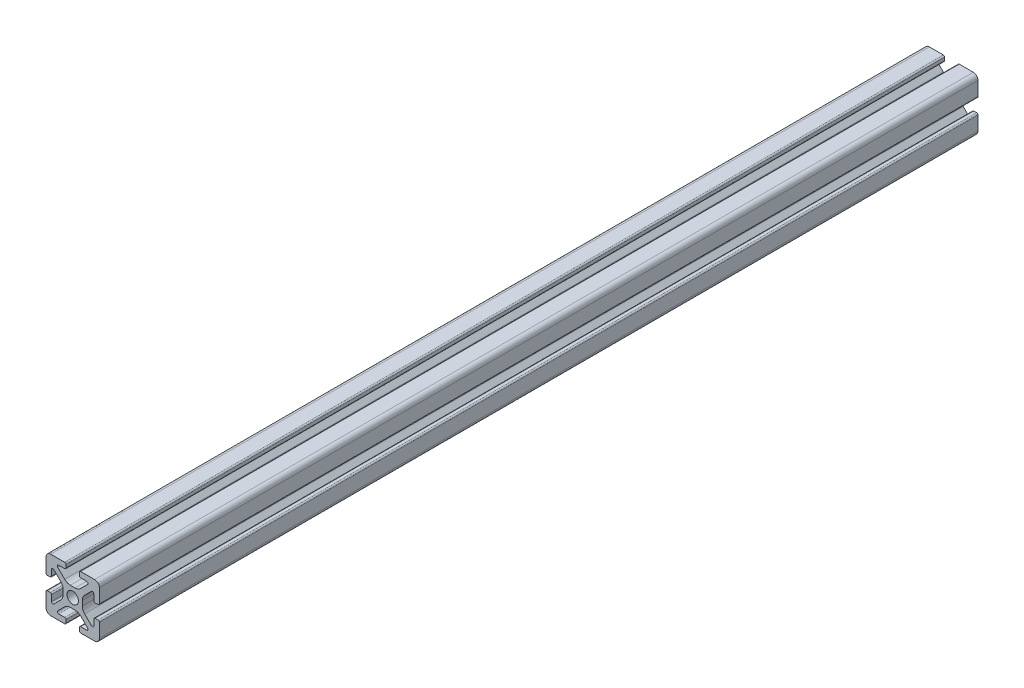
from build123d import *

# Parameters (mm, degrees)
BOSS_EXTRUDE1_DEPTH = 304.8
SKETCH5_W           = 26.995197012
SKETCH5_H           = 24.68705749
CUT_EXTRUDE1_DEPTH  = 280.025


with BuildPart() as part:
    # Sketch4 → Boss-Extrude1 (new, symmetric)
    with BuildSketch(Plane.XY):
        with BuildLine():
            Line((3, -10), (8.25, -10))
            ThreePointArc((8.25, -10), (9.487436867, -9.487436867), (10, -8.25))
            Line((10, -8.25), (10, -3))
            ThreePointArc((10, -3), (9.853553391, -2.646446609), (9.5, -2.5))
            Line((9.5, -2.5), (8.424621202, -2.5))
            ThreePointArc((8.424621202, -2.5), (8.071067812, -2.646446609), (7.924621202, -3))
            Line((7.924621202, -3), (7.924621202, -5.25))
            ThreePointArc((7.924621202, -5.25), (7.615962919, -5.711939766), (7.071067812, -5.603553391))
            Line((7.071067812, -5.603553391), (4.478679656, -3.011165235))
            ThreePointArc((4.478679656, -3.011165235), (3.828361402, -2.037895189), (3.6, -0.889844892))
            Line((3.6, -0.889844892), (3.6, 0))
            Line((3.6, 0), (2.15, 0))
            ThreePointArc((2.15, 0), (1.52027958, -1.52027958), (0, -2.15))
            Line((0, -2.15), (0, -3.6))
            Line((0, -3.6), (0.889844892, -3.6))
            ThreePointArc((0.889844892, -3.6), (2.037895189, -3.828361402), (3.011165235, -4.478679656))
            Line((3.011165235, -4.478679656), (5.603553391, -7.071067812))
            ThreePointArc((5.603553391, -7.071067812), (5.711939766, -7.615962919), (5.25, -7.924621202))
            Line((5.25, -7.924621202), (3, -7.924621202))
            ThreePointArc((3, -7.924621202), (2.646446609, -8.071067812), (2.5, -8.424621202))
            Line((2.5, -8.424621202), (2.5, -9.5))
            ThreePointArc((2.5, -9.5), (2.646446609, -9.853553391), (3, -10))
        make_face()
    extrude(amount=BOSS_EXTRUDE1_DEPTH, both=True)

    # Mirror1: part across plane


with BuildPart() as part_1:
    add(part.part)
    add(part.part.mirror(Plane(origin=(0, 0, 0), x_dir=(0, 0, 1), z_dir=(1, 0, 0))))

    # Mirror2: part across plane


with BuildPart() as part_2:
    add(part_1.part)
    add(part_1.part.mirror(Plane.ZX))

    # Sketch5 → Cut-Extrude1 (cut)
    with BuildSketch(Plane(origin=(0, 0, -304.8), x_dir=(-1, 0, 0), z_dir=(0, 0, -1))):
        with Locations((-0.333544011, -0.025224209)):
            Rectangle(SKETCH5_W, SKETCH5_H)
    extrude(amount=-CUT_EXTRUDE1_DEPTH, mode=Mode.SUBTRACT)


solid = part_2.part
